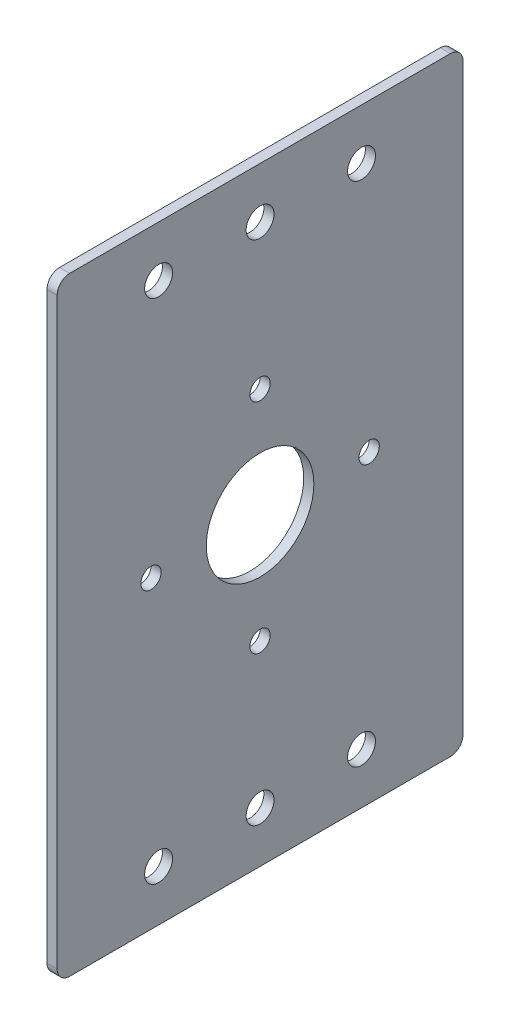
from build123d import *

# Parameters (mm, degrees)
SKETCH1_W           = 101.6
SKETCH1_H           = 152.4
SKETCH1_R           = 2.54
SKETCH1_R_2         = 13.462
BOSS_EXTRUDE2_DEPTH = 2.54
SKETCH2_R           = 3.4925
CUT_EXTRUDE1_DEPTH  = 184.179615678
LPATTERN2_COUNT     = 2
LPATTERN2_PITCH     = 25.4
LPATTERN3_COUNT     = 2
LPATTERN3_PITCH     = 25.4
FILLET1_R           = 3.175


with BuildPart() as part:
    # Sketch1 → Boss-Extrude2 (new body)
    with BuildSketch(Plane(origin=(0, 0, 0), x_dir=(0, 0, -1), z_dir=(1, 0, 0))):
        with Locations((50.8, 76.2)):
            Rectangle(SKETCH1_W, SKETCH1_H)
        with Locations((78.105, 76.2)):
            Circle(SKETCH1_R, mode=Mode.SUBTRACT)
        with Locations((50.8, 76.2)):
            Circle(SKETCH1_R_2, mode=Mode.SUBTRACT)
        with Locations((50.8, 48.895)):
            Circle(SKETCH1_R, mode=Mode.SUBTRACT)
        with Locations((23.495, 76.2)):
            Circle(SKETCH1_R, mode=Mode.SUBTRACT)
        with Locations((50.8, 103.505)):
            Circle(SKETCH1_R, mode=Mode.SUBTRACT)
    extrude(amount=BOSS_EXTRUDE2_DEPTH)

    # Sketch2 → Cut-Extrude1 (cut, through all)
    with BuildSketch(Plane(origin=(2.54, 0, 0), x_dir=(0, 0, -1), z_dir=(1, 0, 0))):
        with Locations((50.8, 139.7)):
            Circle(SKETCH2_R)
        with Locations((50.8, 12.7)):
            Circle(SKETCH2_R)
    cut_extrude1 = extrude(amount=-CUT_EXTRUDE1_DEPTH, mode=Mode.SUBTRACT)

    # LPattern2: Cut-Extrude1 ×2
    with Locations(*[(0, 0, -i * LPATTERN2_PITCH) for i in range(1, LPATTERN2_COUNT)]):
        add(cut_extrude1, mode=Mode.SUBTRACT)

    # LPattern3: Cut-Extrude1 ×2
    with Locations(*[(0, 0, i * LPATTERN3_PITCH) for i in range(1, LPATTERN3_COUNT)]):
        add(cut_extrude1, mode=Mode.SUBTRACT)

    # Fillet1
    fillet1_edges = [part.edges().sort_by_distance(p)[0] for p in [
        (1.27, 0, -101.6),
        (1.27, 0, 0),
        (1.27, 152.4, -101.6),
        (1.27, 152.4, 0),
    ]]
    fillet(fillet1_edges, radius=FILLET1_R)


solid = part.part
